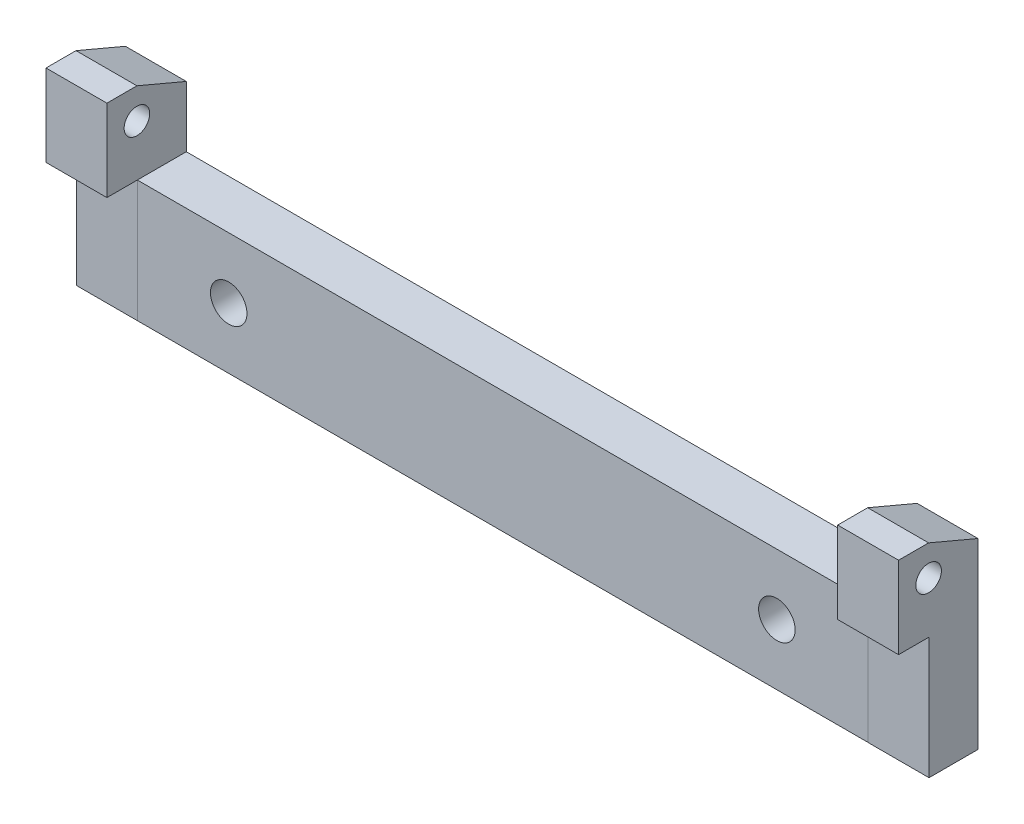
from build123d import *

# Parameters (mm, degrees)
SKETCH_1_R          = 2.1
EXTRUDE_1_DEPTH     = 10
SKETCH_2_R          = 2.1
EXTRUDE_2_DEPTH     = 10
EXTRUDE_3_DEPTH     = 20
SKETCH_4_R          = 3
CUT_EXTRUDE_1_DEPTH = 20


with BuildPart() as part:
    # Эскиз1 → Бобышка-Вытянуть1 (new body)
    with BuildSketch(Plane(origin=(120, 0, 0), x_dir=(0, 0, -1), z_dir=(1, 0, 0))):
        Polygon((27.888881523, 13.434002899), (36, 10), (36, -20), (27.958257708, -20), (27.958257708, 0), (22.958257708, 0), (22.958257708, 13.434002899), align=None)
        with Locations((27.888881523, 8.434002899)):
            Circle(SKETCH_1_R, mode=Mode.SUBTRACT)
    extrude(amount=EXTRUDE_1_DEPTH)



with BuildPart() as body_2:
    # Эскиз2 → Бобышка-Вытянуть2 (new body)
    with BuildSketch(Plane.ZY):
        Polygon((-22.958257708, 13.434002899), (-27.888881523, 13.434002899), (-36, 10), (-36, -20), (-27.958257708, -20), (-27.958257708, 0), (-22.958257708, 0), align=None)
        with Locations(Location((-27.888881523, 8.434002899, 0), (0, 0, 180))):
            Circle(SKETCH_2_R, mode=Mode.SUBTRACT)
    extrude(amount=EXTRUDE_2_DEPTH)


with BuildPart() as part_1:
    add(part.part)

    add(body_2.part)  # Бобышка-Вытянуть3 merges body 2
    # Эскиз3 → Бобышка-Вытянуть3 (add)
    with BuildSketch(Plane(origin=(0, 0, 0), x_dir=(-1, 0, 0), z_dir=(0, -1, 0))):
        Polygon((-120, 27.975706714), (0, 27.958257708), (0, 36), (-120, 36), align=None)
    extrude(amount=EXTRUDE_3_DEPTH)

    # Эскиз4 → Вырез-Вытянуть1 (cut)
    with BuildSketch(Plane(origin=(-0.004065365, 0, -27.958257117), x_dir=(0.9999999894282007, 0, -0.00014540838614521652), z_dir=(0.00014540838614521652, 0, 0.9999999894282007))):
        with Locations((15.004065365, -10)):
            Circle(SKETCH_4_R)
        with Locations((105.004064097, -10)):
            Circle(SKETCH_4_R)
    extrude(amount=-CUT_EXTRUDE_1_DEPTH, mode=Mode.SUBTRACT)


solid = part_1.part
